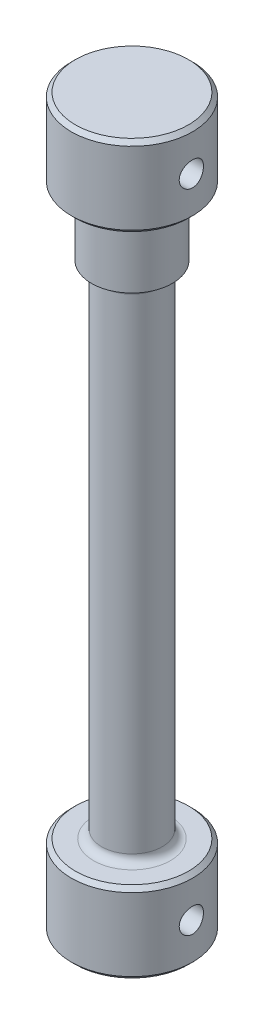
from build123d import *

# Parameters (mm, degrees)
ESQUISSE2_R             = 3
ENL_V_MAT_EXTRU_1_DEPTH = 25


with BuildPart() as part:
    # Esquisse1 → Base-Révolution (revolve)
    with BuildSketch(Plane.XY, mode=Mode.PRIVATE) as base_r_volution_sk:
        with BuildLine():
            Line((0, 0), (-14, 0))
            Line((-14, 0), (-15, -1))
            Line((-15, -1), (-15, -19))
            Line((-15, -19), (-14, -20))
            Line((-14, -20), (-12, -20))
            ThreePointArc((-12, -20), (-10.585786438, -20.585786438), (-10, -22))
            Line((-10, -22), (-10, -36))
            Line((-10, -36), (-9.5, -36))
            ThreePointArc((-9.5, -36), (-8.085786438, -36.585786438), (-7.5, -38))
            Line((-7.5, -38), (-7.5, -158))
            ThreePointArc((-7.5, -158), (-8.085786438, -159.414213562), (-9.5, -160))
            Line((-9.5, -160), (-14, -160))
            Line((-14, -160), (-15, -161))
            Line((-15, -161), (-15, -179))
            Line((-15, -179), (-14, -180))
            Line((-14, -180), (0, -180))
            Line((0, -180), (0, 0))
        make_face()
    revolve(base_r_volution_sk.sketch.rotate(Axis((0, 0, 0), (0, -1, 0)), 270), axis=Axis((0, 0, 0), (0, -1, 0)))

    # Esquisse2 → Enlèv. mat.-Extru.1 (cut, symmetric)
    with BuildSketch(Plane(origin=(0, 0, 0), x_dir=(0, 0, -1), z_dir=(1, 0, 0))):
        with Locations((0, -10)):
            Circle(ESQUISSE2_R)
        with Locations((0, -170)):
            Circle(ESQUISSE2_R)
    extrude(amount=ENL_V_MAT_EXTRU_1_DEPTH, both=True, mode=Mode.SUBTRACT)


solid = part.part
